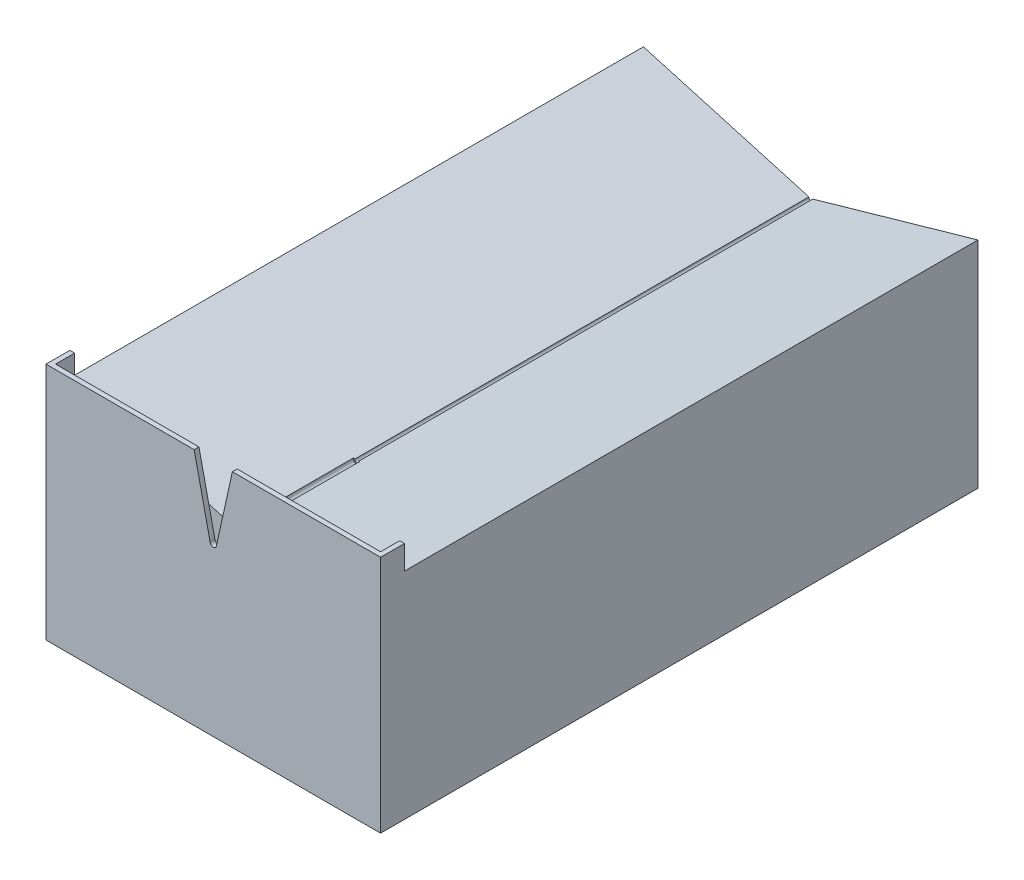
from build123d import *

# Parameters (mm, degrees)
RESSALTO_EXTRUS_O2_DEPTH = 120
ESBO_O2_W                = 70
ESBO_O2_H                = 50
RESSALTO_EXTRUS_O3_DEPTH = 5
ESBO_O3_W                = 68
ESBO_O3_H                = 4
CORTE_EXTRUS_O1_DEPTH    = 48
ESBO_O5_R                = 0.4
CORTE_EXTRUS_O4_DEPTH    = 127
ESBO_O6_R                = 0.675
CORTE_EXTRUS_O6_DEPTH    = 30
CORTE_EXTRUS_O7_DEPTH    = 4


with BuildPart() as part:
    # Esboço1 → Ressalto-extrusão2 (new body)
    with BuildSketch(Plane.XY):
        with BuildLine():
            Line((35, -22.5), (-35, -22.5))
            Line((-35, -22.5), (-35, 22.5))
            Line((-35, 22.5), (-0.384609579, 12.609888451))
            ThreePointArc((-0.384609579, 12.609888451), (0.03064267, 12.068183293), (0.42886001, 12.622531431))
            Line((0.42886001, 12.622531431), (35, 22.5))
            Line((35, 22.5), (35, -22.5))
        make_face()
    extrude(amount=RESSALTO_EXTRUS_O2_DEPTH)

    # Esboço2 → Ressalto-extrusão3 (add)
    with BuildSketch(Plane.XY.offset(120)):
        with Locations((0, 2.5)):
            Rectangle(ESBO_O2_W, ESBO_O2_H)
    extrude(amount=RESSALTO_EXTRUS_O3_DEPTH)

    # Esboço3 → Corte-extrusão1 (cut)
    with BuildSketch(Plane(origin=(0, 27.5, 0), x_dir=(1, 0, 0), z_dir=(0, 1, 0))):
        with Locations((0, -122)):
            Rectangle(ESBO_O3_W, ESBO_O3_H)
    extrude(amount=-CORTE_EXTRUS_O1_DEPTH, mode=Mode.SUBTRACT)

    # Esboço5 → Corte-extrusão4 (cut)
    with BuildSketch(Plane(origin=(0, 0, 0), x_dir=(-1, 0, 0), z_dir=(0, 0, -1))):
        with Locations((0, 12.5)):
            Circle(ESBO_O5_R)
    extrude(amount=-CORTE_EXTRUS_O4_DEPTH, mode=Mode.SUBTRACT)

    # Esboço6 → Corte-extrusão6 (cut)
    with BuildSketch(Plane.XY.offset(125)):
        with Locations((0, 12.5)):
            Circle(ESBO_O6_R)
    extrude(amount=-CORTE_EXTRUS_O6_DEPTH, mode=Mode.SUBTRACT)

    # Esboço7 → Corte-extrusão7 (cut)
    with BuildSketch(Plane.XY.offset(125)):
        Polygon((0.675, 12.5), (4, 27.5), (0, 27.5), (-4, 27.5), (-0.675, 12.5), align=None)
    extrude(amount=-CORTE_EXTRUS_O7_DEPTH, mode=Mode.SUBTRACT)


solid = part.part
